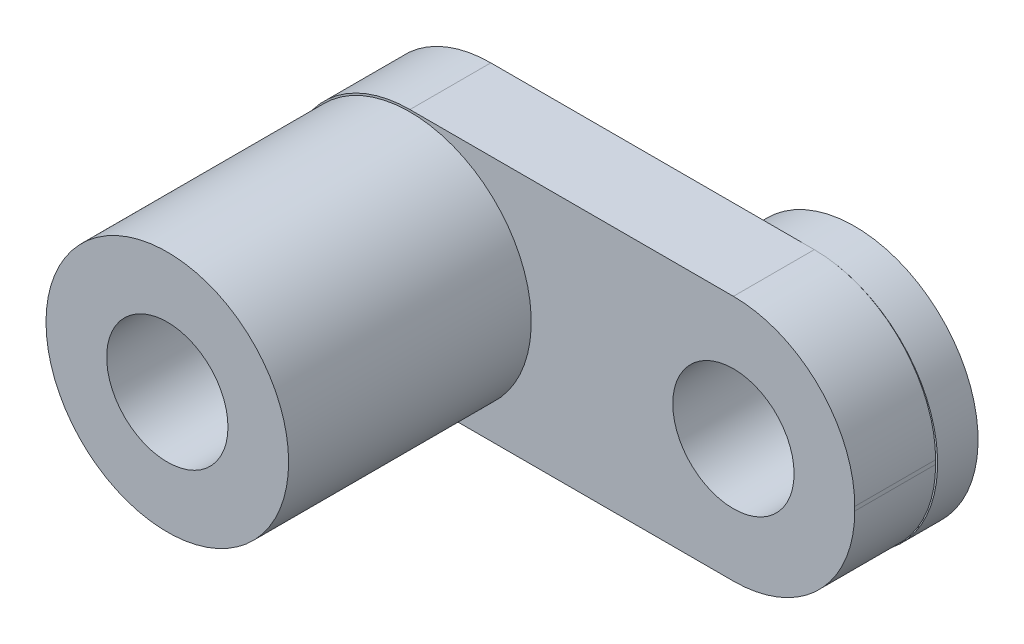
from build123d import *

# Parameters (mm, degrees)
EXTRUSION1_DEPTH             = 2
ESQUISSE2_R                  = 3
EXTRUSION2_DEPTH             = 6
ESQUISSE3_R                  = 3.05
EXTRUSION3_DEPTH             = 1
ENL_V_MAT_EXTRU_1_DEPTH      = 17.450303949
ENL_V_MAT_EXTRU_1_DEPTH_BACK = 17.450303949
ESQUISSE4_R                  = 1.5


with BuildPart() as part:
    # Esquisse1 → Extrusion1 (new body)
    with BuildSketch(Plane.XY):
        with BuildLine():
            Line((3, 0), (11, 0))
            ThreePointArc((11, 0), (13.121320344, 0.878679656), (14, 3))
            Line((14, 3), (14, 3.1))
            ThreePointArc((14, 3.1), (13.121320344, 5.221320344), (11, 6.1))
            Line((11, 6.1), (3, 6.1))
            ThreePointArc((3, 6.1), (0.878679656, 5.221320344), (0, 3.1))
            Line((0, 3.1), (0, 3))
            ThreePointArc((0, 3), (0.878679656, 0.878679656), (3, 0))
        make_face()
    extrude(amount=EXTRUSION1_DEPTH)

    # Esquisse2 → Extrusion2 (add)
    with BuildSketch(Plane.XY.offset(2)):
        with Locations(Location((3, 3.05, 0), (0, 0, 180))):
            Circle(ESQUISSE2_R)
    extrude(amount=EXTRUSION2_DEPTH)

    # Esquisse3 → Extrusion3 (add)
    with BuildSketch(Plane(origin=(0, 0, 0), x_dir=(-1, 0, 0), z_dir=(0, 0, -1))):
        with Locations(Location((-11, 3.05, 0), (0, 0, 270))):
            Circle(ESQUISSE3_R)
    extrude(amount=EXTRUSION3_DEPTH)

    # Esquisse4 → Enlèv. mat.-Extru.1 (cut, two sides: drawn at the far end of the back side and taken through both)
    with BuildSketch(Plane.XY.offset(2).offset(-ENL_V_MAT_EXTRU_1_DEPTH_BACK)):
        with Locations((3, 3.05)):
            Circle(ESQUISSE4_R)
        with Locations((11, 3.05)):
            Circle(ESQUISSE4_R)
    extrude(amount=ENL_V_MAT_EXTRU_1_DEPTH + ENL_V_MAT_EXTRU_1_DEPTH_BACK, mode=Mode.SUBTRACT)


solid = part.part
